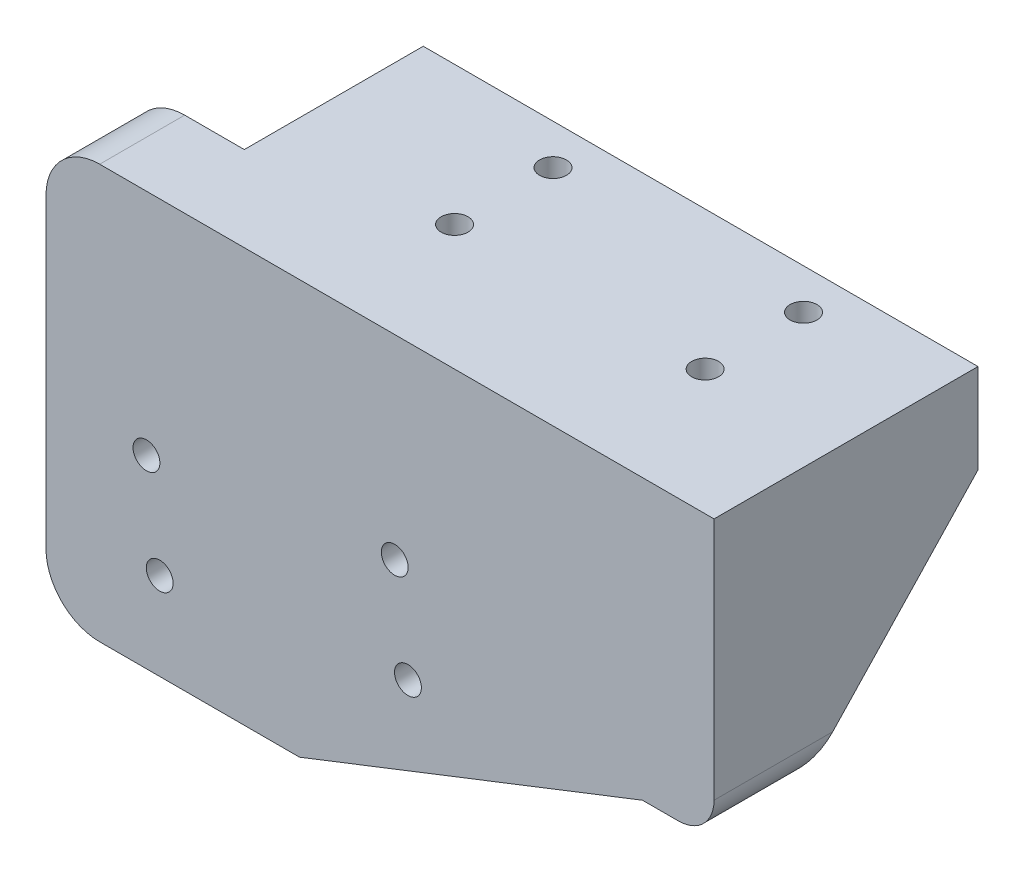
from build123d import *

# Parameters (mm, degrees)
SKETCH_1_W               = 42
SKETCH_1_H               = 20
EXTRUDE_1_DEPTH          = 10
SKETCH_2_R               = 1.5
CUT_EXTRUDE_1_DEPTH      = 26.317977802
SKETCH_3_W               = 12
SKETCH_3_H               = 20
EXTRUDE_2_DEPTH          = 10
SKETCH_4_W               = 126.664391462
SKETCH_4_H               = 46.229783625
EXTRUDE_3_DEPTH          = 9.5
SKETCH_5_R               = 1.5
CUT_EXTRUDE_2_DEPTH      = 116.532726292
SKETCH_6_W               = 60
SKETCH_6_H               = 46.229783625
CUT_EXTRUDE_3_DEPTH      = 116.532726292
EXTRUDE_4_DEPTH          = 8
CUT_EXTRUDE_4_DEPTH      = 66.33057377
CUT_EXTRUDE_4_DEPTH_BACK = 66.33057377
RIB_1_REACH              = 87.25
SKETCH_10_WALL_W         = 201.667483308
SKETCH_10_WALL_H         = 8
CUT_EXTRUDE_5_DEPTH      = 62.626567883
EXTRUDE_5_DEPTH          = 8
FILLET_1_R               = 3
FILLET_2_R               = 4
FILLET_3_R               = 6


with BuildPart() as part:
    # 草图1 → 凸台-拉伸1 (new body)
    with BuildSketch(Plane(origin=(0, 0, 0), x_dir=(1, 0, 0), z_dir=(0, 1, 0))):
        Rectangle(SKETCH_1_W, SKETCH_1_H)
    extrude(amount=EXTRUDE_1_DEPTH)

    # 草图2 → 切除-拉伸1 (cut, through all)
    with BuildSketch(Plane(origin=(0, 10, 0), x_dir=(1, 0, 0), z_dir=(0, 1, 0))):
        with Locations(Location((-14, 5.5, 0), (0, 0, 270))):
            Circle(SKETCH_2_R)
        with Locations(Location((14, 5.5, 0), (0, 0, 90))):
            Circle(SKETCH_2_R)
        with Locations(Location((14, -5.5, 0), (0, 0, 270))):
            Circle(SKETCH_2_R)
        with Locations(Location((-14, -5.5, 0), (0, 0, 90))):
            Circle(SKETCH_2_R)
    extrude(amount=-CUT_EXTRUDE_1_DEPTH, mode=Mode.SUBTRACT)

    # 草图3 → 凸台-拉伸2 (add)
    with BuildSketch(Plane.XZ):
        with Locations((-27, 0)):
            Rectangle(SKETCH_3_W, SKETCH_3_H)
    extrude(amount=-EXTRUDE_2_DEPTH)

    # 草图4 → 凸台-拉伸3 (add)
    with BuildSketch(Plane.XY.offset(10)):
        with Locations((-42.332195731, -13.114891813)):
            Rectangle(SKETCH_4_W, SKETCH_4_H)
    extrude(amount=EXTRUDE_3_DEPTH)

    # 草图5 → 切除-拉伸2 (cut, through all)
    with BuildSketch(Plane.XY.offset(19.5)):
        with Locations((-34.435554727, -15.563062213)):
            Circle(SKETCH_5_R)
        with Locations((-6.689582963, -11.799945041)):
            Circle(SKETCH_5_R)
        with Locations((-5.211215503, -22.700148234)):
            Circle(SKETCH_5_R)
        with Locations((-32.957187267, -26.463265406)):
            Circle(SKETCH_5_R)
    extrude(amount=-CUT_EXTRUDE_2_DEPTH, mode=Mode.SUBTRACT)

    # 草图6 → 切除-拉伸3 (cut, through all)
    with BuildSketch(Plane.XY.offset(19.5)):
        with Locations((-75.664391462, -13.114891813)):
            Rectangle(SKETCH_6_W, SKETCH_6_H)
    extrude(amount=-CUT_EXTRUDE_3_DEPTH, mode=Mode.SUBTRACT)

    # 草图8 → 凸台-拉伸4 (add)
    with BuildSketch(Plane(origin=(21, 0, 0), x_dir=(0, 0, -1), z_dir=(1, 0, 0))):
        Polygon((-10, 0), (10, 0), (10, 10), (-19.5, 10), (-19.5, -36.229783625), (-10, -36.229783625), align=None)
    extrude(amount=EXTRUDE_4_DEPTH)

    # 草图9 → 切除-拉伸4 (cut, two sides: drawn at the far end of the back side and taken through both)
    with BuildSketch(Plane.XY.offset(19.5).offset(-CUT_EXTRUDE_4_DEPTH_BACK)):
        Polygon((29, -21.229783625), (-8.332195731, -36.229783625), (29, -36.229783625), align=None)
    extrude(amount=CUT_EXTRUDE_4_DEPTH + CUT_EXTRUDE_4_DEPTH_BACK, mode=Mode.SUBTRACT)

    # 草图10 wall → 筋1 (add, up to next)
    with BuildSketch(Plane(origin=(29, -10.614891812, 0), x_dir=(0, 0.727874330628, -0.685710550315), z_dir=(0, 0.685710550315, 0.727874330628)), mode=Mode.PRIVATE) as rib_1_sk1:
        with Locations((0, 4)):
            Rectangle(SKETCH_10_WALL_W, SKETCH_10_WALL_H)
    rib_1_tool1 = extrude(rib_1_sk1.sketch, amount=RIB_1_REACH, mode=Mode.PRIVATE) - part.part
    add(rib_1_tool1.solids().sort_by_distance((29, -10.614891812, 0))[0])

    # 草图12 → 切除-拉伸5 (cut, through all)
    with BuildSketch(Plane(origin=(0, 0, 10), x_dir=(-1, 0, 0), z_dir=(0, 0, -1))):
        Polygon((17.332195731, -36.229783625), (-21, -21.229783625), (-29, -21.229783625), (8.332195731, -36.229783625), align=None)
    extrude(amount=-CUT_EXTRUDE_5_DEPTH, mode=Mode.SUBTRACT)

    # 草图13 → 凸台-拉伸5 (add)
    with BuildSketch(Plane(origin=(-26.664391462, 0, 0), x_dir=(0, 0, -1), z_dir=(1, 0, 0))):
        Polygon((-10, -36.229783625), (10, 0), (-10, 0), align=None)
    extrude(amount=EXTRUDE_5_DEPTH)

    # 圆角1
    fillet_1_edges = [part.edges().sort_by_distance(p)[0] for p in [
        (21, 0, 0),
        (-26.664391462, 0, 0),
        (-18.664391462, 0, 0),
    ]]
    fillet(fillet_1_edges, radius=FILLET_1_R)

    # 圆角2
    fillet_2_edges = [part.edges().sort_by_distance(p)[0] for p in [
        (29, -21.229783625, 14.75),
    ]]
    fillet(fillet_2_edges, radius=FILLET_2_R)

    # 圆角3
    fillet_3_edges = [part.edges().sort_by_distance(p)[0] for p in [
        (-45.664391462, 10, 14.75),
        (-45.664391462, -36.229783625, 14.75),
    ]]
    fillet(fillet_3_edges, radius=FILLET_3_R)


solid = part.part
